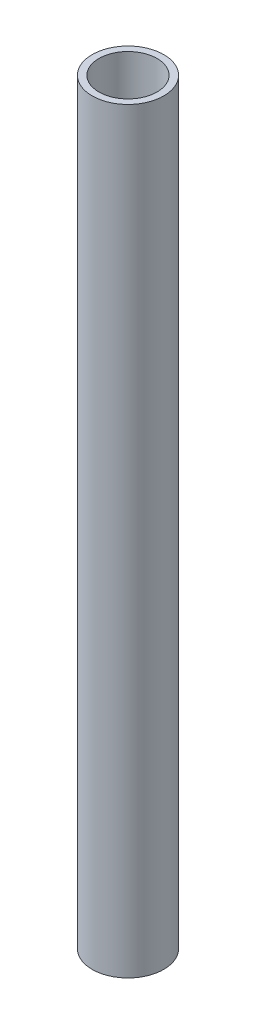
from build123d import *

# Parameters (mm, degrees)
SKETCH_1_R      = 10.65
SKETCH_1_R_2    = 8.65
EXTRUDE_1_DEPTH = 225


with BuildPart() as part:
    # Эскиз1 → Бобышка-Вытянуть1 (new body)
    with BuildSketch(Plane(origin=(0, 0, 0), x_dir=(1, 0, 0), z_dir=(0, 1, 0))):
        with Locations(Location((0, -1.5, 0), (0, 0, 270))):
            Circle(SKETCH_1_R)
        with Locations(Location((0, -1.5, 0), (0, 0, 270))):
            Circle(SKETCH_1_R_2, mode=Mode.SUBTRACT)
    extrude(amount=EXTRUDE_1_DEPTH)


solid = part.part
